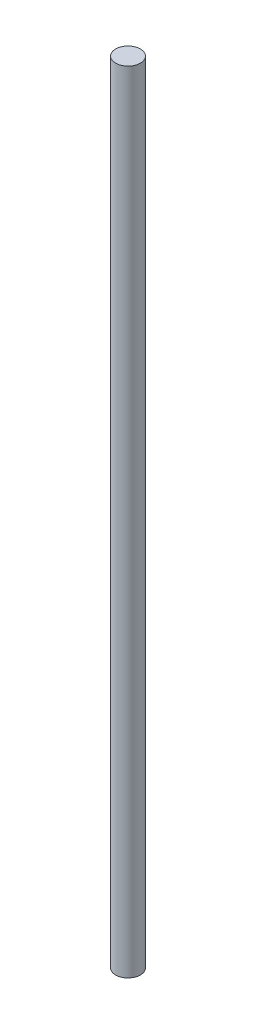
from build123d import *

# Parameters (mm, degrees)
SKETCH1_R           = 4.7625
BOSS_EXTRUDE1_DEPTH = 304.8


with BuildPart() as part:
    # Sketch1 → Boss-Extrude1 (new body)
    with BuildSketch(Plane(origin=(0, 0, 0), x_dir=(1, 0, 0), z_dir=(0, 1, 0))):
        with Locations(Location((0, 0, 0), (0, 0, 90))):
            Circle(SKETCH1_R)
    extrude(amount=BOSS_EXTRUDE1_DEPTH)


solid = part.part
